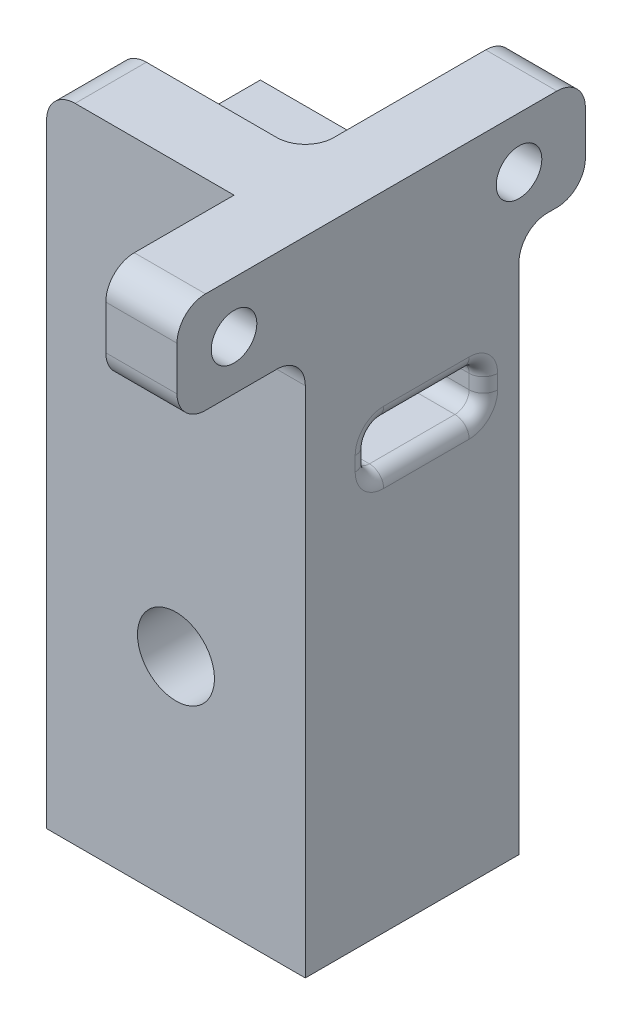
from build123d import *

# Parameters (mm, degrees)
SKETCH1_W           = 23.056445047489827
SKETCH1_H           = 95.25
SKETCH1_R           = 1.2700000000000005
SKETCH1_R_2         = 1.269999999999998
BOSS_EXTRUDE1_DEPTH = 6.35
SKETCH2_W           = 23.056445047489827
SKETCH2_H           = 48.26
BOSS_EXTRUDE2_DEPTH = 12.7
CUT_EXTRUDE2_DEPTH  = 55.41534970233967
SKETCH6_R           = 3.4289999999999994
CUT_EXTRUDE3_DEPTH  = 53.57321599024526
FILLET2_R           = 1.27
BOSS_EXTRUDE3_DEPTH = 6.35
SKETCH9_R           = 1.9049999999999996
SKETCH9_R_2         = 1.905
CUT_EXTRUDE4_DEPTH  = 53.43149307056342
FILLET4_R           = 2.54
BOSS_EXTRUDE7_DEPTH = 6.35
FILLET5_R           = 2.54
FILLET6_R           = 2.54
SKETCH13_R          = 2.0319999999999987
SKETCH13_R_2        = 2.032000000000001
CUT_EXTRUDE5_DEPTH  = 6.35
FILLET7_R           = 2.54
SKETCH14_W          = 8.8077942060624
SKETCH14_H          = 39.07493764297598
CUT_EXTRUDE6_DEPTH  = 45.21200000000002
SKETCH15_W          = 6.35
SKETCH15_H          = 6.35
CUT_EXTRUDE7_DEPTH  = 7.112000000000007
FILLET8_R           = 2.54


with BuildPart() as part:
    # Sketch1 → Boss-Extrude1 (new body)
    # profile 1 of 4: a face of its own
    with BuildSketch(Plane.XY):
        Rectangle(SKETCH1_W, SKETCH1_H)
        Polygon((7.9121000000000015, 16.687800000000006), (7.9121000000000015, 44.449999999999996), (-7.912099999999998, 44.45), (-7.912099999999998, 16.687800000000006), align=None, mode=Mode.SUBTRACT)
    # profile 2 of 4: a face of its own
    with BuildSketch(Plane.XY):
        Polygon((-7.912099999999998, 16.687800000000006), (7.9121000000000015, 16.687800000000006), (7.9121000000000015, 44.449999999999996), (-7.912099999999998, 44.45), align=None)
        with Locations((5.372100000000001, 19.227800000000006)):
            Circle(SKETCH1_R, mode=Mode.SUBTRACT)
        with Locations((-5.372099999999998, 41.910000000000004)):
            Circle(SKETCH1_R_2, mode=Mode.SUBTRACT)
    # profile 3 of 4: a face of its own
    with BuildSketch(Plane.XY):
        with Locations((-5.372099999999998, 41.910000000000004)):
            Circle(SKETCH1_R_2)
    # profile 4 of 4: a face of its own
    with BuildSketch(Plane.XY):
        with Locations((5.372100000000001, 19.227800000000006)):
            Circle(SKETCH1_R)
    extrude(amount=BOSS_EXTRUDE1_DEPTH)

    # Sketch2 → Boss-Extrude2 (add)
    with BuildSketch(Plane(origin=(0, 0, 0), x_dir=(-1, 0, 0), z_dir=(0, 0, -1))):
        with Locations((0, -23.495)):
            Rectangle(SKETCH2_W, SKETCH2_H)
    extrude(amount=BOSS_EXTRUDE2_DEPTH)

    # Sketch5 → Cut-Extrude2 (cut, through all)
    with BuildSketch(Plane(origin=(11.528222523744914, 0, 0), x_dir=(0, 0, -1), z_dir=(1, 0, 0))):
        Polygon((-0.6350000000000019, -12.065000000000001), (9.524999999999997, -12.065000000000001), (9.524999999999999, -8.255000000000003), (-0.6350000000000019, -8.255000000000003), align=None)
    extrude(amount=-CUT_EXTRUDE2_DEPTH, mode=Mode.SUBTRACT)

    # Sketch6 → Cut-Extrude3 (cut, through all)
    with BuildSketch(Plane(origin=(0, 0, -12.7), x_dir=(-1, 0, 0), z_dir=(0, 0, -1))):
        with Locations((0, -28.575)):
            Circle(SKETCH6_R)
    extrude(amount=-CUT_EXTRUDE3_DEPTH, mode=Mode.SUBTRACT)

    # Fillet2
    fillet2_edges = [part.edges().sort_by_distance(p)[0] for p in [
        (-11.528222523744914, -10.160000000000004, -9.524999999999999),
        (0, -8.255000000000003, -9.524999999999999),
        (-11.528222523744914, -12.065, -4.444999999999998),
        (0, -12.065000000000001, -9.524999999999997),
        (-11.528222523744914, -10.16, 0.6350000000000019),
        (0, -12.065000000000001, 0.6350000000000019),
        (-11.528222523744914, -8.255000000000003, -4.4449999999999985),
        (0, -8.255000000000003, 0.6350000000000019),
        (11.528222523744914, -10.160000000000002, -9.524999999999999),
        (11.528222523744914, -8.255000000000003, -4.4449999999999985),
        (11.528222523744914, -10.160000000000002, 0.6350000000000019),
        (11.528222523744914, -12.065000000000001, -4.444999999999998),
    ]]
    fillet(fillet2_edges, radius=FILLET2_R)

    # Sketch8 → Boss-Extrude3 (add)
    with BuildSketch(Plane.ZY.offset(11.528222523744914)):
        Polygon((6.35, 47.625), (-1.21e-15, 47.625), (0, 6.98625472546675), (6.350000000000005, 6.986254725466751), align=None)
    extrude(amount=BOSS_EXTRUDE3_DEPTH)

    # Sketch9 → Cut-Extrude4 (cut, through all)
    with BuildSketch(Plane.XY):
        with Locations((-4.594022523744915, 12.877800000000006)):
            Circle(SKETCH9_R)
        with Locations((-15.338222523744914, 35.56)):
            Circle(SKETCH9_R_2)
    extrude(amount=CUT_EXTRUDE4_DEPTH, mode=Mode.SUBTRACT)

    # Fillet4
    fillet4_edges = [part.edges().sort_by_distance(p)[0] for p in [
        (11.528222523744914, 47.625, 3.175),
        (-17.878222523744913, 47.625, 3.1749999999999994),
    ]]
    fillet(fillet4_edges, radius=FILLET4_R)

    # Sketch12 → Boss-Extrude7 (add)
    with BuildSketch(Plane(origin=(11.528222523744914, 0, 0), x_dir=(0, 0, -1), z_dir=(1, 0, 0))):
        Polygon((-6.35, 0.6349999999999898), (18.613653389650153, 0.6349999999999898), (18.613653389650153, 9.627193152709879), (-17.78195834691587, 9.627193152709879), (-17.78195834691587, 0.6349999999999898), align=None)
    extrude(amount=-BOSS_EXTRUDE7_DEPTH)

    # Fillet5
    fillet5_edges = [part.edges().sort_by_distance(p)[0] for p in [
        (8.353222523744913, 0.6349999999999967, -12.7),
        (5.178222523744914, 5.131096576354938, 0),
        (8.353222523744915, 0.6349999999999898, 6.35),
    ]]
    fillet(fillet5_edges, radius=FILLET5_R)

    # Fillet6
    fillet6_edges = [part.edges().sort_by_distance(p)[0] for p in [
        (5.178222523744914, -0.6350000000000069, -12.7),
    ]]
    fillet(fillet6_edges, radius=FILLET6_R)

    # Sketch13 → Cut-Extrude5 (cut)
    with BuildSketch(Plane(origin=(11.528222523744914, 0, 0), x_dir=(0, 0, -1), z_dir=(1, 0, 0))):
        with Locations((-12.70195834691587, 5.050717249087455)):
            Circle(SKETCH13_R)
        with Locations((12.698041653084129, 5.050717249087455)):
            Circle(SKETCH13_R_2)
    extrude(amount=-CUT_EXTRUDE5_DEPTH, mode=Mode.SUBTRACT)

    # Fillet7
    fillet7_edges = [part.edges().sort_by_distance(p)[0] for p in [
        (8.353222523744915, 0.6349999999999898, -18.613653389650153),
        (8.353222523744915, 0.6349999999999898, 17.78195834691587),
        (8.353222523744915, 9.627193152709879, 17.78195834691587),
        (8.353222523744915, 9.627193152709879, -18.613653389650153),
    ]]
    fillet(fillet7_edges, radius=FILLET7_R)

    # Sketch14 → Cut-Extrude6 (cut)
    with BuildSketch(Plane(origin=(11.528222523744914, 0, 0), x_dir=(0, 0, -1), z_dir=(1, 0, 0))):
        with Locations((-1.9461028969687981, 29.16466197419787)):
            Rectangle(SKETCH14_W, SKETCH14_H)
    extrude(amount=-CUT_EXTRUDE6_DEPTH, mode=Mode.SUBTRACT)

    # Sketch15 → Cut-Extrude7 (cut)
    with BuildSketch(Plane.XZ.offset(-6.98625472546675)):
        with Locations((-14.703222523744913, 3.1750000000000007)):
            Rectangle(SKETCH15_W, SKETCH15_H)
    extrude(amount=-CUT_EXTRUDE7_DEPTH, mode=Mode.SUBTRACT)

    # Fillet8
    fillet8_edges = [part.edges().sort_by_distance(p)[0] for p in [
        (-11.528222523744914, 9.627193152709879, 3.1750000000000007),
    ]]
    fillet(fillet8_edges, radius=FILLET8_R)


solid = part.part
